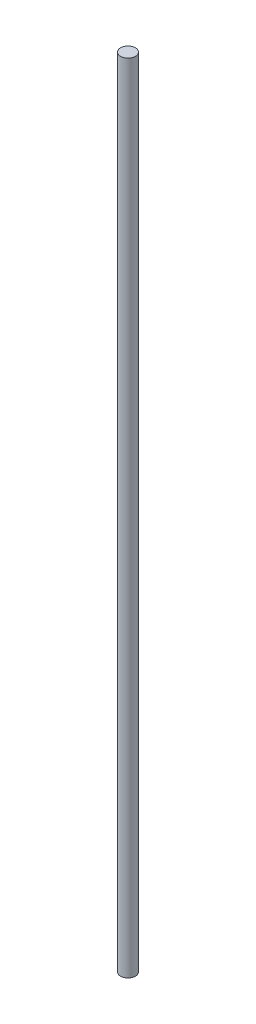
from build123d import *

# Parameters (mm, degrees)
SKETCH1_R           = 4
BOSS_EXTRUDE1_DEPTH = 430


with BuildPart() as part:
    # Sketch1 → Boss-Extrude1 (new body)
    with BuildSketch(Plane(origin=(0, 0, 0), x_dir=(1, 0, 0), z_dir=(0, 1, 0))):
        with Locations(Location((0, 0, 0), (0, 0, 270))):
            Circle(SKETCH1_R)
    extrude(amount=BOSS_EXTRUDE1_DEPTH)


solid = part.part
